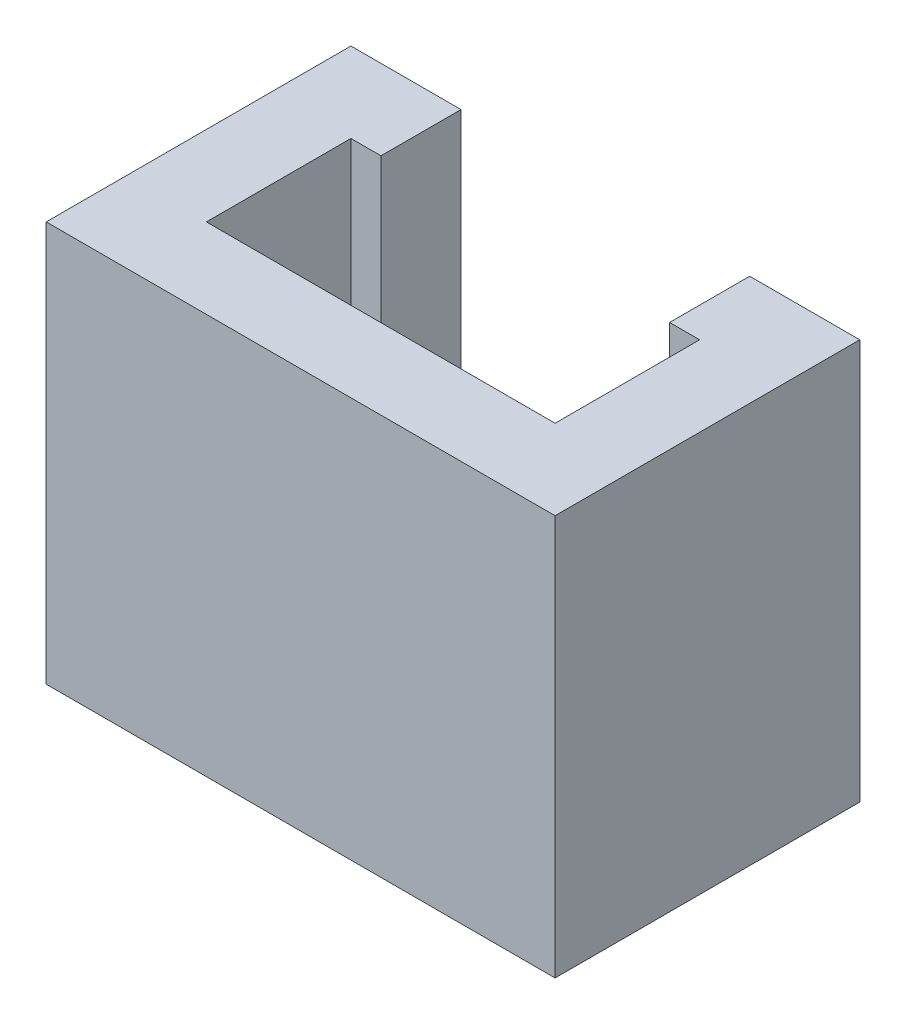
from build123d import *

# Parameters (mm, degrees)
BOSS_EXTRUDE1_DEPTH = 20


with BuildPart() as part:
    # Sketch1 → Boss-Extrude1 (new body)
    with BuildSketch(Plane(origin=(0, 0, 0), x_dir=(1, 0, 0), z_dir=(0, 1, 0))):
        Polygon((-8.71, 0), (8.71, 0), (8.71, 7.22), (7.21, 7.22), (7.21, 11.22), (12.71, 11.22), (12.71, -4), (-12.71, -4), (-12.71, 11.22), (-7.21, 11.22), (-7.21, 7.22), (-8.71, 7.22), align=None)
    extrude(amount=BOSS_EXTRUDE1_DEPTH)


solid = part.part
